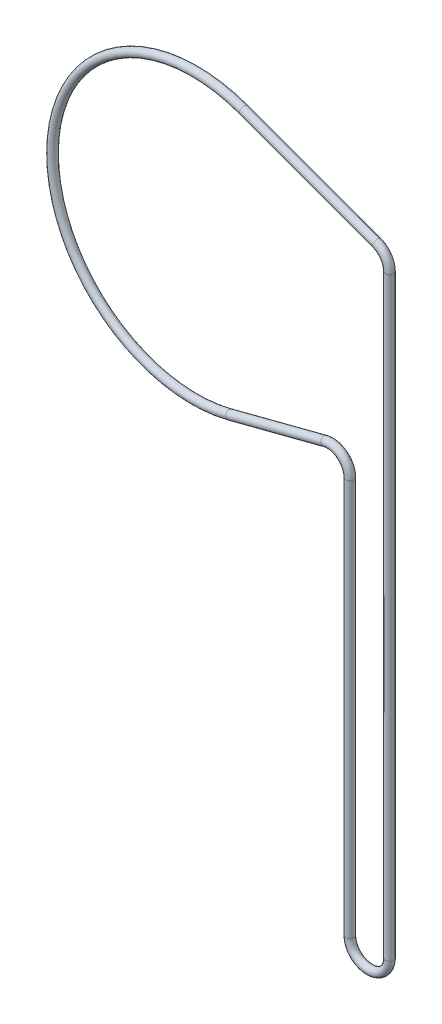
from build123d import *

# Parameters (mm, degrees)
ESQUISSE1_R = 1.25


with BuildPart() as part:
    # Balayage1: sweep along a path in Esquisse2
    with BuildLine(Plane.XY) as balayage1_path:
        Line((0, 0), (0, 180))
        ThreePointArc((0, 180), (-1.081920065, 183.436930281), (-3.937496585, 185.63436595))
        Line((-3.937496585, 185.63436595), (-44.218725526, 200.379622645))
        ThreePointArc((-44.218725526, 200.379622645), (-101.948863448, 162.096456184), (-48.221714597, 118.372742539))
        Line((-48.221714597, 118.372742539), (-19.5039468, 125.80845453))
        ThreePointArc((-19.5039468, 125.80845453), (-14.327377014, 124.744664414), (-12, 120))
        Line((-12, 120), (-12, 0))
        ThreePointArc((-12, 0), (-6, -6), (0, 0))
    # Esquisse1 → Balayage1 (sweep)
    with BuildSketch(Plane(origin=(0, 0, 0), x_dir=(1, 0, 0), z_dir=(0, 1, 0))):
        Circle(ESQUISSE1_R)
    sweep(path=balayage1_path.line)


solid = part.part
